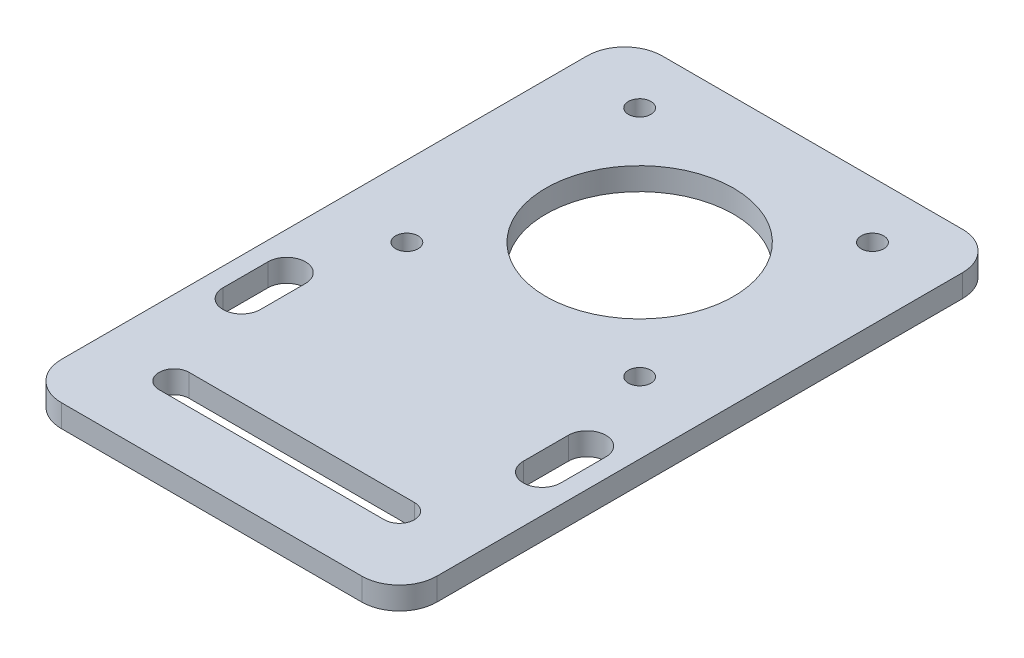
from build123d import *

# Parameters (mm, degrees)
SKETCH1_W           = 50
SKETCH1_H           = 80
BOSS_EXTRUDE1_DEPTH = 3
SKETCH2_R           = 1.5
SKETCH2_R_2         = 12.5
CUT_EXTRUDE1_DEPTH  = 48.265209192
FILLET1_R           = 5
CUT_EXTRUDE2_DEPTH  = 48.265209192


with BuildPart() as part:
    # Sketch1 → Boss-Extrude1 (new body)
    with BuildSketch(Plane(origin=(0, 0, 0), x_dir=(1, 0, 0), z_dir=(0, 1, 0))):
        Rectangle(SKETCH1_W, SKETCH1_H)
    extrude(amount=BOSS_EXTRUDE1_DEPTH)

    # Sketch2 → Cut-Extrude1 (cut, through all)
    with BuildSketch(Plane(origin=(0, 3, 0), x_dir=(1, 0, 0), z_dir=(0, 1, 0))):
        with Locations(Location((15.5, 32.5, 0), (0, 0, 270))):
            Circle(SKETCH2_R)
        with Locations(Location((-15.5, 32.5, 0), (0, 0, 270))):
            Circle(SKETCH2_R)
        with Locations(Location((-15.5, 1.5, 0), (0, 0, 270))):
            Circle(SKETCH2_R)
        with Locations(Location((15.5, 1.5, 0), (0, 0, 270))):
            Circle(SKETCH2_R)
        with Locations(Location((0, 17, 0), (0, 0, 270))):
            Circle(SKETCH2_R_2)
        with BuildLine():
            Line((-15, -28), (15, -28))
            ThreePointArc((15, -28), (17, -30), (15, -32))
            Line((15, -32), (-15, -32))
            ThreePointArc((-15, -32), (-17, -30), (-15, -28))
        make_face()
    extrude(amount=-CUT_EXTRUDE1_DEPTH, mode=Mode.SUBTRACT)

    # Fillet1
    fillet1_edges = [part.edges().sort_by_distance(p)[0] for p in [
        (-25, 1.5, -40),
        (25, 1.5, -40),
        (25, 1.5, 40),
        (-25, 1.5, 40),
    ]]
    fillet(fillet1_edges, radius=FILLET1_R)

    # Sketch3 → Cut-Extrude2 (cut, through all)
    with BuildSketch(Plane(origin=(0, 3, 0), x_dir=(1, 0, 0), z_dir=(0, 1, 0))):
        with BuildLine():
            Line((22.5, -10), (22.5, -16))
            ThreePointArc((22.5, -16), (20, -18.5), (17.5, -16))
            Line((17.5, -16), (17.5, -10))
            ThreePointArc((17.5, -10), (20, -7.5), (22.5, -10))
        make_face()
        with BuildLine():
            Line((-22.5, -10), (-22.5, -16))
            ThreePointArc((-22.5, -16), (-20, -18.5), (-17.5, -16))
            Line((-17.5, -16), (-17.5, -10))
            ThreePointArc((-17.5, -10), (-20, -7.5), (-22.5, -10))
        make_face()
    extrude(amount=-CUT_EXTRUDE2_DEPTH, mode=Mode.SUBTRACT)


solid = part.part
